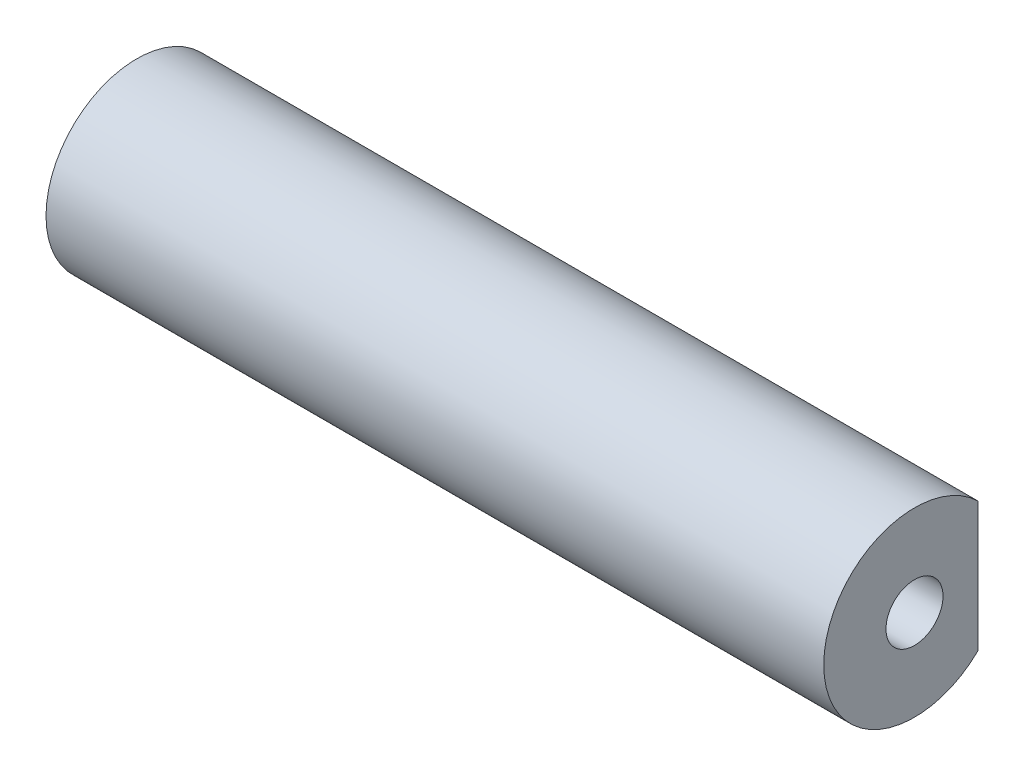
from build123d import *

# Parameters (mm, degrees)
SKETCH1_R           = 3.5
BOSS_EXTRUDE1_DEPTH = 30
SKETCH2_R           = 1.2
CUT_EXTRUDE1_DEPTH  = 15
SKETCH3_R           = 1.1
CUT_EXTRUDE2_DEPTH  = 15
CUT_EXTRUDE3_START  = -30
CUT_EXTRUDE3_DEPTH  = 30


with BuildPart() as part:
    # Sketch1 → Boss-Extrude1 (new body)
    with BuildSketch(Plane(origin=(0, 0, 0), x_dir=(0, 0, -1), z_dir=(1, 0, 0))):
        Circle(SKETCH1_R)
    extrude(amount=BOSS_EXTRUDE1_DEPTH)

    # Sketch2 → Cut-Extrude1 (cut)
    with BuildSketch(Plane.ZY):
        Circle(SKETCH2_R)
    extrude(amount=-CUT_EXTRUDE1_DEPTH, mode=Mode.SUBTRACT)

    # Sketch3 → Cut-Extrude2 (cut)
    with BuildSketch(Plane(origin=(30, 0, 0), x_dir=(0, 0, -1), z_dir=(1, 0, 0))):
        Circle(SKETCH3_R)
    extrude(amount=-CUT_EXTRUDE2_DEPTH, mode=Mode.SUBTRACT)

    # Sketch4 → Cut-Extrude3 (cut)
    with BuildSketch(Plane(origin=(30, 0, 0), x_dir=(0, 0, -1), z_dir=(1, 0, 0)).offset(CUT_EXTRUDE3_START)):
        with BuildLine():
            Line((2.449489743, 2.5), (2.449489743, -2.5))
            ThreePointArc((2.449489743, -2.5), (3.5, 0), (2.449489743, 2.5))
        make_face()
    extrude(amount=CUT_EXTRUDE3_DEPTH, mode=Mode.SUBTRACT)


solid = part.part
